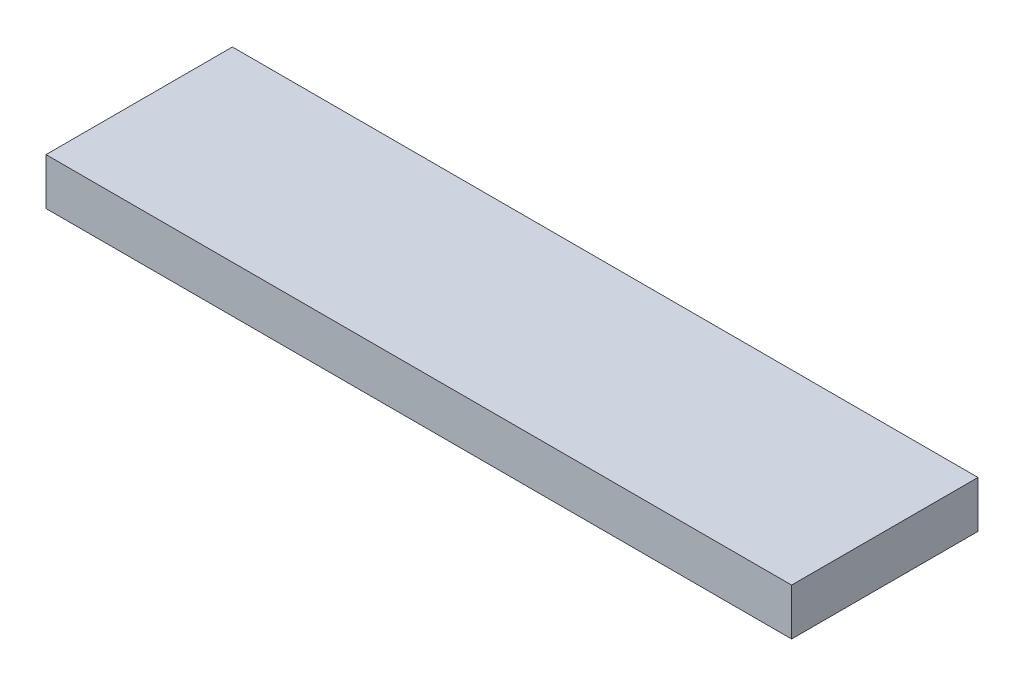
from build123d import *

# Parameters (mm, degrees)
SKETCH2_W           = 76.2
SKETCH2_H           = 19.05
BOSS_EXTRUDE2_DEPTH = 4.7752


with BuildPart() as part:
    # Sketch2 → Boss-Extrude2 (new body)
    with BuildSketch(Plane(origin=(0, 0, 0), x_dir=(1, 0, 0), z_dir=(0, 1, 0))):
        Rectangle(SKETCH2_W, SKETCH2_H)
    extrude(amount=BOSS_EXTRUDE2_DEPTH)


solid = part.part
